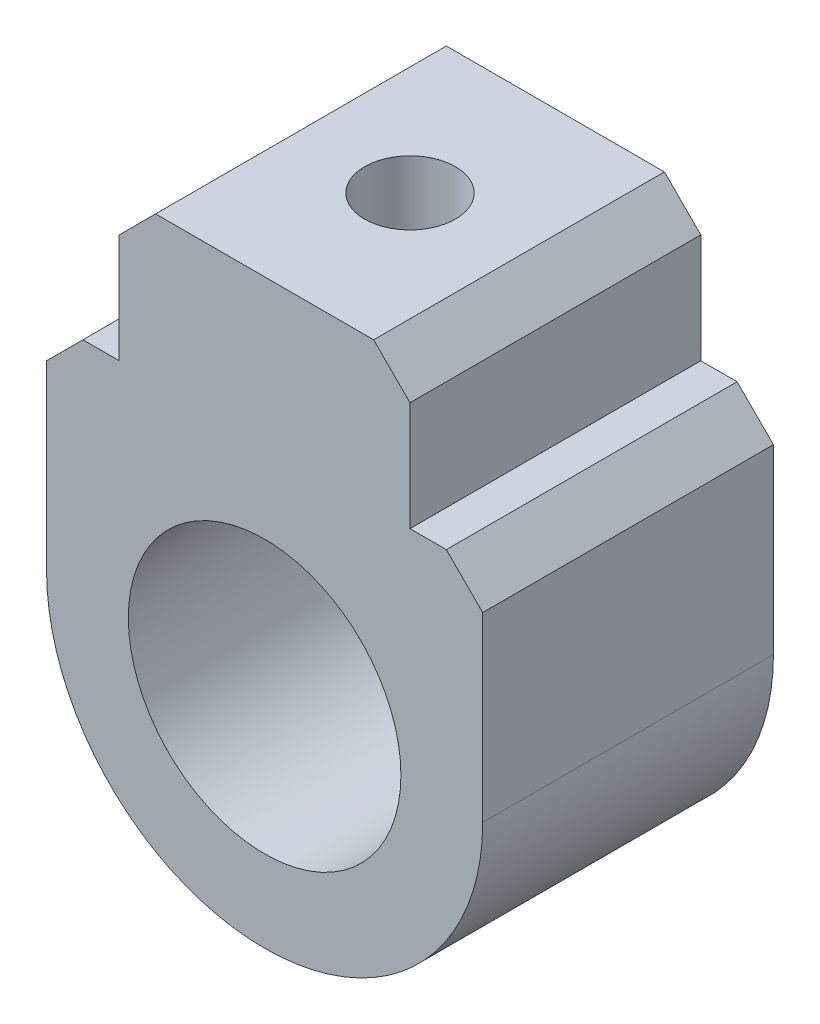
from build123d import *

# Parameters (mm, degrees)
SKETCH1_R           = 3.75
BOSS_EXTRUDE2_DEPTH = 8
SKETCH11_R          = 1.25
CUT_EXTRUDE5_DEPTH  = 5
CHAMFER1_SIZE       = 1


with BuildPart() as part:
    # Sketch1 → Boss-Extrude2 (new body)
    with BuildSketch(Plane.XY):
        with BuildLine():
            Line((-6, 0), (-6, 6))
            Line((-6, 6), (-4, 6))
            Line((-4, 6), (-4, 10))
            Line((-4, 10), (4, 10))
            Line((4, 10), (4, 6))
            Line((4, 6), (6, 6))
            Line((6, 6), (6, 0))
            ThreePointArc((6, 0), (0, -6), (-6, 0))
        make_face()
        Circle(SKETCH1_R, mode=Mode.SUBTRACT)
    extrude(amount=BOSS_EXTRUDE2_DEPTH)

    # Sketch11 → Cut-Extrude5 (cut)
    with BuildSketch(Plane(origin=(0, 10, 0), x_dir=(1, 0, 0), z_dir=(0, 1, 0))):
        with Locations((0, -4)):
            Circle(SKETCH11_R)
    extrude(amount=-CUT_EXTRUDE5_DEPTH, mode=Mode.SUBTRACT)

    # Chamfer1
    chamfer1_edges = [part.edges().sort_by_distance(p)[0] for p in [
        (-6, 6, 4),
        (6, 6, 4),
        (-4, 10, 4),
        (4, 10, 4),
    ]]
    chamfer(chamfer1_edges, length=CHAMFER1_SIZE)


solid = part.part
